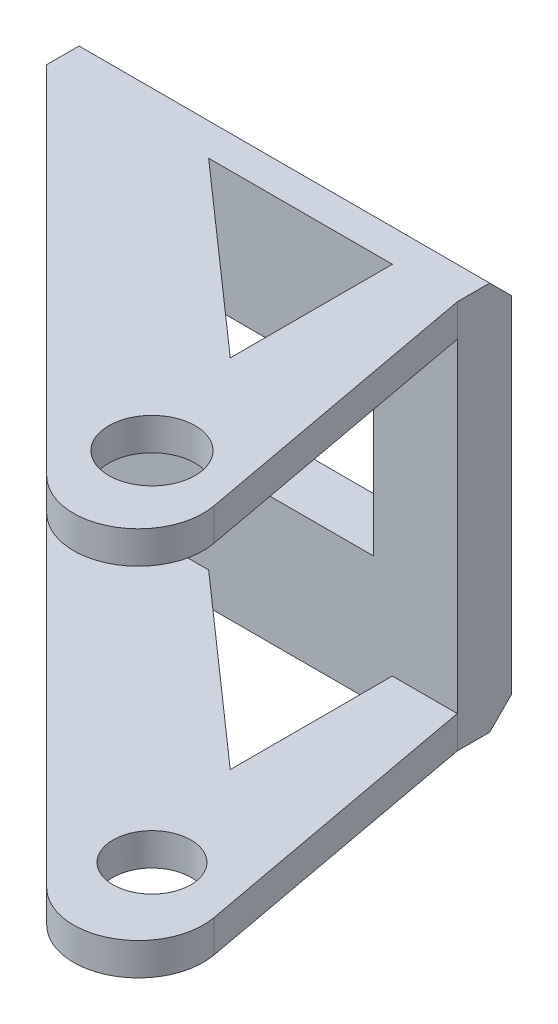
from build123d import *

# Parameters (mm, degrees)
CROQUIS1_W              = 38
CROQUIS1_H              = 36
CROQUIS1_W_2            = 22.5
CROQUIS1_H_2            = 12.5
SALIENTE_EXTRUIR1_DEPTH = 5
SALIENTE_EXTRUIR2_DEPTH = 3
REDONDEO1_R             = 6
SALIENTE_EXTRUIR3_DEPTH = 3
CROQUIS4_W              = 32.5
CROQUIS4_H              = 12.5
CORTAR_EXTRUIR1_DEPTH   = 1.5
CORTAR_EXTRUIR2_DEPTH   = 41.5
CHAFL_N1_SIZE           = 2
CROQUIS6_R              = 3.6
CORTAR_EXTRUIR4_DEPTH   = 10
CROQUIS7_R              = 4
CORTAR_EXTRUIR5_DEPTH   = 10


with BuildPart() as part:
    # Croquis1 → Saliente-Extruir1 (new body)
    with BuildSketch(Plane.XY):
        Rectangle(CROQUIS1_W, CROQUIS1_H)
        Rectangle(CROQUIS1_W_2, CROQUIS1_H_2, mode=Mode.SUBTRACT)
    extrude(amount=SALIENTE_EXTRUIR1_DEPTH)

    # Croquis3 → Saliente-Extruir3 (add)
    with BuildSketch(Plane(origin=(0, 18, 0), x_dir=(1, 0, 0), z_dir=(0, 1, 0))):
        with BuildLine():
            Line((-19, -5), (19, -5))
            Line((19, -5), (24.09786452, -32.623312397))
            ThreePointArc((24.09786452, -32.623312397), (20.989161561, -39.023212548), (13.954861208, -37.954861208))
            Line((13.954861208, -37.954861208), (-19, -5))
        make_face()
    extrude(amount=-SALIENTE_EXTRUIR3_DEPTH)

    # Croquis4 → Cortar-Extruir1 (cut)
    with BuildSketch(Plane(origin=(0, 0, 0), x_dir=(-1, 0, 0), z_dir=(0, 0, -1))):
        Rectangle(CROQUIS4_W, CROQUIS4_H)
    extrude(amount=-CORTAR_EXTRUIR1_DEPTH, mode=Mode.SUBTRACT)


with BuildPart() as body_2:
    # Croquis2 → Saliente-Extruir2 (new body)
    with BuildSketch(Plane.XZ.offset(18)):
        Polygon((-19, 5), (27.6, 51.6), (19, 5), align=None)
    extrude(amount=-SALIENTE_EXTRUIR2_DEPTH)

    # Redondeo1
    redondeo1_edges = [body_2.edges().sort_by_distance(p)[0] for p in [
        (27.6, -16.5, 51.6),
    ]]
    fillet(redondeo1_edges, radius=REDONDEO1_R)


with BuildPart() as cortar_extruir2_tool:
    # Croquis5 → Cortar-Extruir2 (new body)
    with BuildSketch(Plane.XZ.offset(18)):
        Polygon((-4.011879288, 5), (12.988120712, 5), (12.988120712, 20), align=None)
    extrude(amount=-CORTAR_EXTRUIR2_DEPTH)


with BuildPart() as part_1:
    add(part.part)

    # Cortar-Extruir2: cut by cortar_extruir2_tool
    add(cortar_extruir2_tool.part, mode=Mode.SUBTRACT)

    # Chaflán1
    chafl_n1_edges = [part_1.edges().sort_by_distance(p)[0] for p in [
        (0, 18, 0),
        (0, -18, 0),
    ]]
    chamfer(chafl_n1_edges, length=CHAFL_N1_SIZE)

    # Croquis7 → Cortar-Extruir5 (cut)
    with BuildSketch(Plane(origin=(0, 18, 0), x_dir=(1, 0, 0), z_dir=(0, 1, 0))):
        with Locations(Location((16.801672063, -31.056724508, 0), (0, 0, 180))):
            Circle(CROQUIS7_R)
    extrude(amount=-CORTAR_EXTRUIR5_DEPTH, mode=Mode.SUBTRACT)


with BuildPart() as body_2_1:
    add(body_2.part)

    # Cortar-Extruir2: cut by cortar_extruir2_tool
    add(cortar_extruir2_tool.part, mode=Mode.SUBTRACT)

    # Croquis6 → Cortar-Extruir4 (cut)
    with BuildSketch(Plane.XZ.offset(18)):
        with Locations((16.801672063, 31.056724508)):
            Circle(CROQUIS6_R)
    extrude(amount=-CORTAR_EXTRUIR4_DEPTH, mode=Mode.SUBTRACT)


solid = Compound([part_1.part, body_2_1.part])
